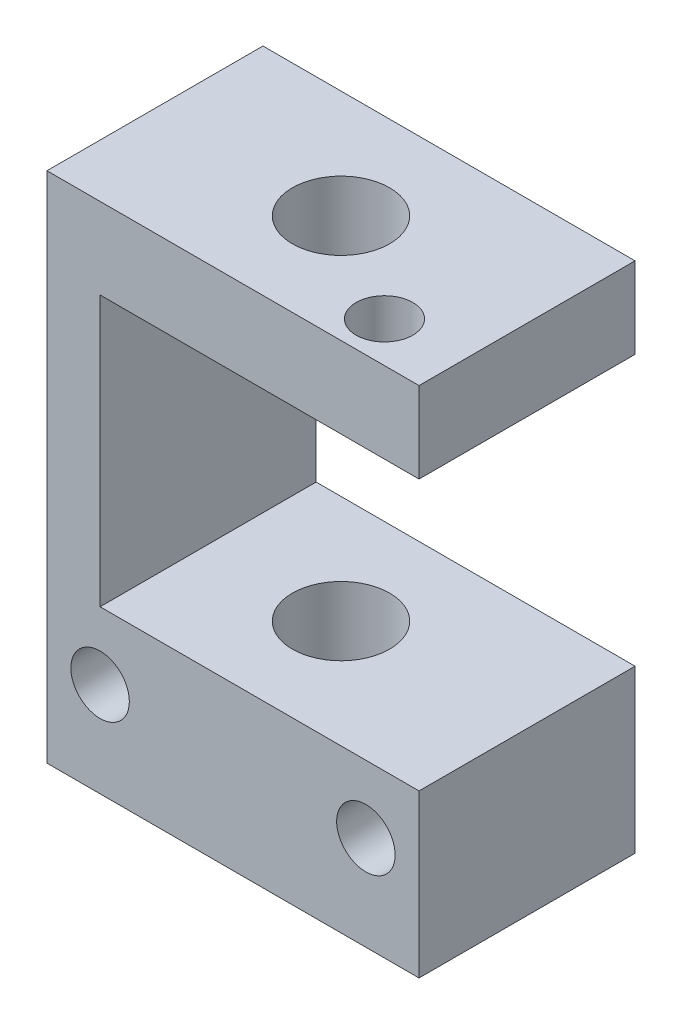
from build123d import *

# Parameters (mm, degrees)
SKETCH2_W            = 35
SKETCH2_H            = 20.32
SKETCH2_R            = 4.572
BOSS_EXTRUDE1_DEPTH  = 48.26
M5_CLEARANCE_HOLE1_D = 5.5
SKETCH7_R            = 2.667
CUT_EXTRUDE1_DEPTH   = 5
SKETCH8_W            = 30
SKETCH8_H            = 25.4
CUT_EXTRUDE2_DEPTH   = 63.983569286


with BuildPart() as part:
    # Sketch2 → Boss-Extrude1 (new body)
    with BuildSketch(Plane(origin=(0, 0, 0), x_dir=(1, 0, 0), z_dir=(0, 1, 0))):
        with Locations((17.5, 10.16)):
            Rectangle(SKETCH2_W, SKETCH2_H)
        with Locations(Location((17.5, 10.16, 0), (0, 0, 90))):
            Circle(SKETCH2_R, mode=Mode.SUBTRACT)
    extrude(amount=BOSS_EXTRUDE1_DEPTH)

    # M5 Clearance Hole1 (through all)
    with Locations(Plane.XY):
        with Locations((5, 8.89), (30, 8.89)):
            Hole(M5_CLEARANCE_HOLE1_D / 2)

    # Sketch7 → Cut-Extrude1 (cut)
    with BuildSketch(Plane(origin=(0, 48.26, 0), x_dir=(1, 0, 0), z_dir=(0, 1, 0))):
        with Locations(Location((27.94, 3.81, 0), (0, 0, 270))):
            Circle(SKETCH7_R)
    extrude(amount=-CUT_EXTRUDE1_DEPTH, mode=Mode.SUBTRACT)

    # Sketch8 → Cut-Extrude2 (cut, through all)
    with BuildSketch(Plane(origin=(0, 0, -20.32), x_dir=(-1, 0, 0), z_dir=(0, 0, -1))):
        with Locations((-20, 27.94)):
            Rectangle(SKETCH8_W, SKETCH8_H)
    extrude(amount=-CUT_EXTRUDE2_DEPTH, mode=Mode.SUBTRACT)


solid = part.part
